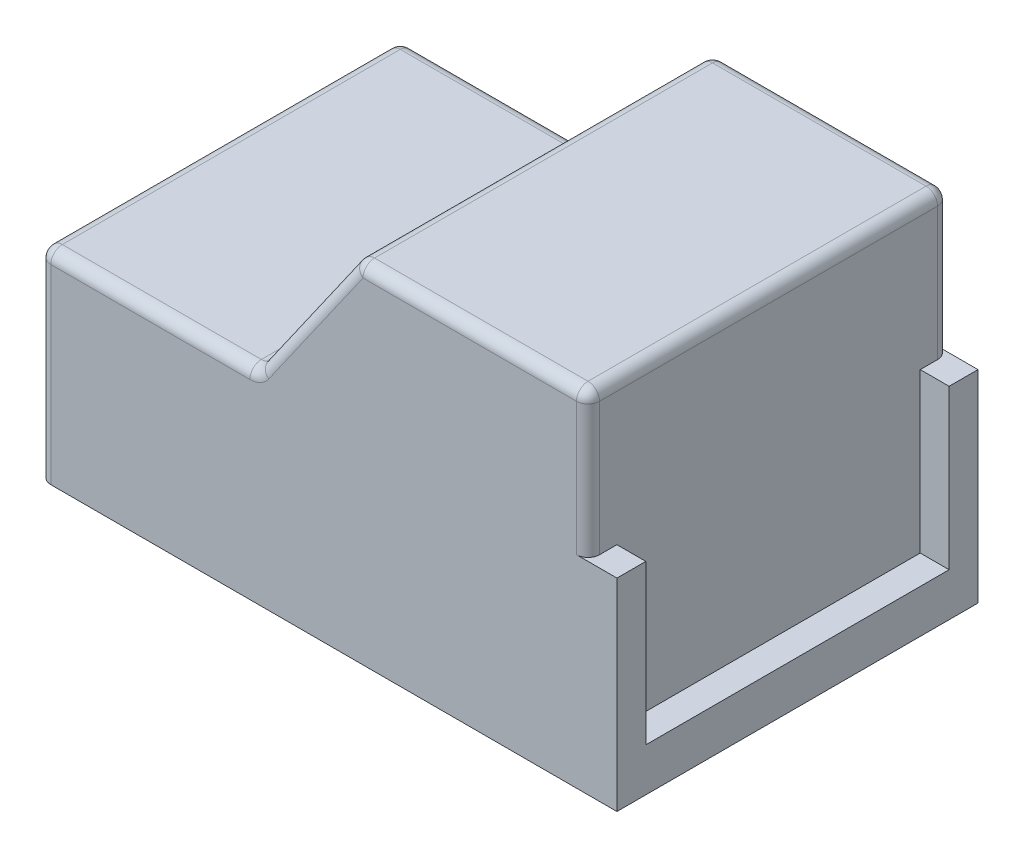
from build123d import *

# Parameters (mm, degrees)
BOSS_EXTRUDE1_DEPTH = 158.75
SKETCH2_W           = 25.4
SKETCH2_H           = 266.7
CUT_EXTRUDE1_DEPTH  = 139.7
FILLET1_R           = 10.16


with BuildPart() as part:
    # Sketch1 → Boss-Extrude1 (new, symmetric)
    with BuildSketch(Plane.XY):
        Polygon((-406.4, 88.9), (-406.4, -88.9), (101.6, -88.9), (101.6, 88.9), (76.2, 88.9), (76.2, 215.9), (-126.973642647, 215.9), (-215.9, 88.9), align=None)
    extrude(amount=BOSS_EXTRUDE1_DEPTH, both=True)

    # Sketch2 → Cut-Extrude1 (cut)
    with BuildSketch(Plane(origin=(0, 88.9, 0), x_dir=(1, 0, 0), z_dir=(0, 1, 0))):
        with Locations((88.9, 0)):
            Rectangle(SKETCH2_W, SKETCH2_H)
    extrude(amount=-CUT_EXTRUDE1_DEPTH, mode=Mode.SUBTRACT)

    # Fillet1
    fillet1_edges = [part.edges().sort_by_distance(p)[0] for p in [
        (-171.436821324, 152.4, 158.75),
        (-171.436821324, 152.4, -158.75),
        (-215.9, 88.9, 0),
        (-311.15, 88.9, 158.75),
        (-406.4, 88.9, 0),
        (-311.15, 88.9, -158.75),
        (76.2, 152.4, -158.75),
        (76.2, 152.4, 158.75),
        (-25.386821324, 215.9, -158.75),
        (-25.386821324, 215.9, 158.75),
        (76.2, 215.9, 0),
        (-126.973642647, 215.9, 0),
        (-406.4, 0, -158.75),
        (-406.4, 0, 158.75),
    ]]
    fillet(fillet1_edges, radius=FILLET1_R)


solid = part.part
